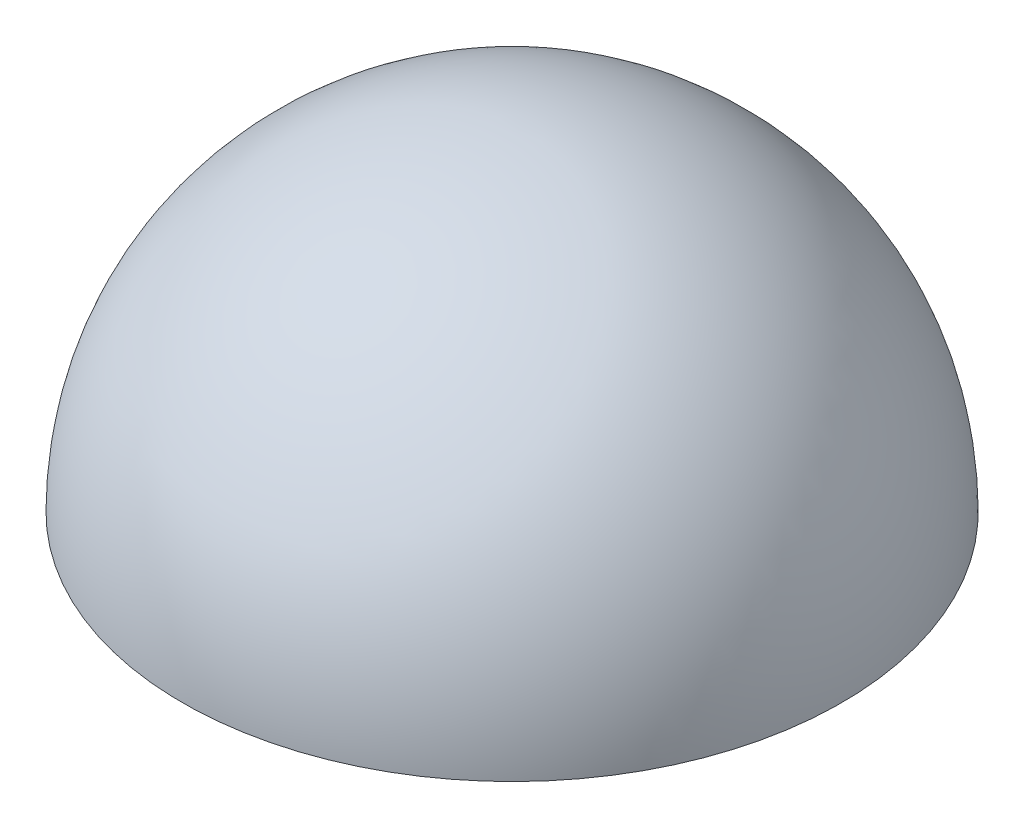
from build123d import *

# Parameters (mm, degrees)
REVOLVE1_ANGLE = 180


with BuildPart() as part:
    # Sketch1 → Revolve1 (revolve)
    with BuildSketch(Plane(origin=(0, 0, 0), x_dir=(1, 0, 0), z_dir=(0, 1, 0))):
        with BuildLine():
            Line((-0.75, 0), (0.75, 0))
            ThreePointArc((0.75, 0), (0, 0.75), (-0.75, 0))
        make_face()
    revolve(axis=Axis((-0.75, 0, 0), (1, 0, 0)), revolution_arc=REVOLVE1_ANGLE)


solid = part.part
